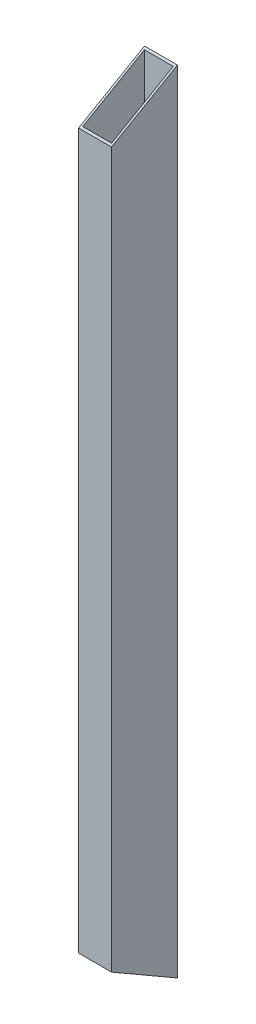
from build123d import *

# Parameters (mm, degrees)
SKETCH1_W               = 25.4
SKETCH1_H               = 50.8
SKETCH1_W_2             = 22.225
SKETCH1_H_2             = 47.625
BOSS_EXTRUDE1_DEPTH     = 609.6
CUT_EXTRUDE1_DEPTH      = 611.657416233
CUT_EXTRUDE2_DEPTH      = 611.261099858
CUT_EXTRUDE2_DEPTH_BACK = 611.261099858


with BuildPart() as part:
    # Sketch1 → Boss-Extrude1 (new body)
    with BuildSketch(Plane(origin=(0, 0, 0), x_dir=(1, 0, 0), z_dir=(0, 1, 0))):
        Rectangle(SKETCH1_W, SKETCH1_H)
        Rectangle(SKETCH1_W_2, SKETCH1_H_2, mode=Mode.SUBTRACT)
    extrude(amount=BOSS_EXTRUDE1_DEPTH)

    # Sketch2 → Cut-Extrude1 (cut, through all)
    with BuildSketch(Plane(origin=(12.7, 0, 0), x_dir=(0, 0, -1), z_dir=(1, 0, 0))):
        Polygon((25.4, 609.6), (-25.4, 609.6), (-25.4, 580.270606325), align=None)
    extrude(amount=-CUT_EXTRUDE1_DEPTH, mode=Mode.SUBTRACT)

    # Sketch3 → Cut-Extrude2 (cut, two sides: drawn at the far end of the back side and taken through both)
    with BuildSketch(Plane(origin=(0, 0, 0), x_dir=(0, 0, -1), z_dir=(1, 0, 0)).offset(-CUT_EXTRUDE2_DEPTH_BACK)):
        Polygon((-25.4, 0), (25.4, 0), (-25.4, 29.329393675), align=None)
    extrude(amount=CUT_EXTRUDE2_DEPTH + CUT_EXTRUDE2_DEPTH_BACK, mode=Mode.SUBTRACT)


solid = part.part
